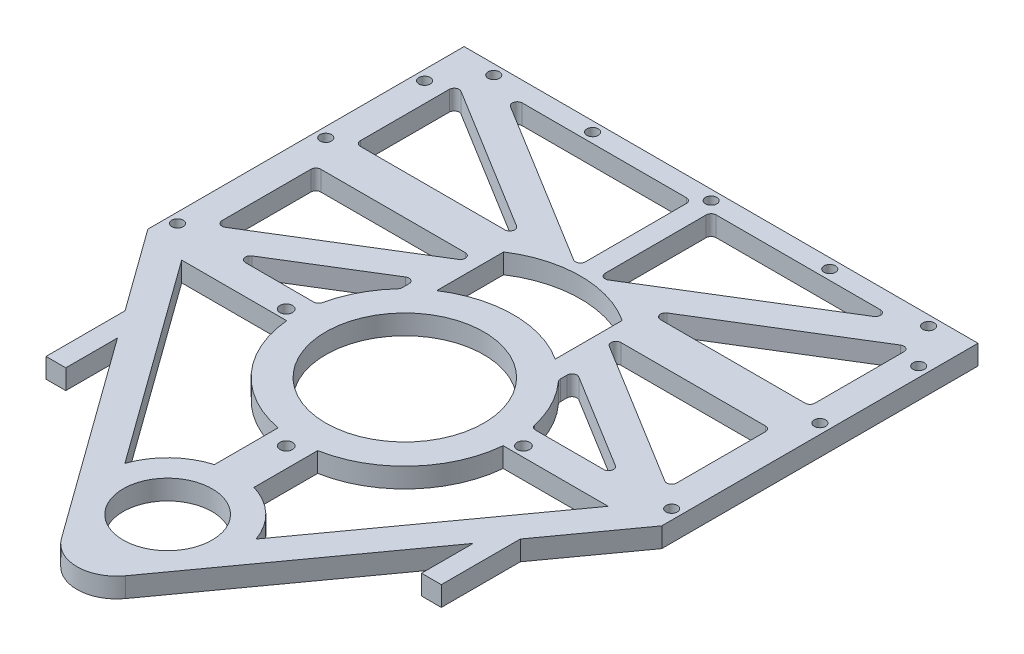
from build123d import *

# Parameters (mm, degrees)
BOSS_EXTRUDE1_DEPTH        = 6.35
BOSS_EXTRUDE2_DEPTH        = 6.35
CUT_EXTRUDE2_REACH         = 178.705
SKETCH3_R                  = 25.4
SKETCH3_R_2                = 14.2875
F_6_CLEARANCE_HOLE1_D      = 3.6576
TAP_DRILL_FOR_10_32_TAP1_D = 4.0386


with BuildPart() as part:
    # Sketch1 → Boss-Extrude1 (new body)
    with BuildSketch(Plane(origin=(0, 0, 0), x_dir=(1, 0, 0), z_dir=(0, 1, 0))):
        with BuildLine():
            Line((-82.55, -50.8), (-10.295626201, -150.844517568))
            ThreePointArc((-10.295626201, -150.844517568), (0, -156.108787534), (10.295626201, -150.844517568))
            Line((10.295626201, -150.844517568), (82.55, -50.8))
            Line((82.55, -50.8), (82.55, 50.8))
            Line((82.55, 50.8), (-82.55, 50.8))
            Line((-82.55, 50.8), (-82.55, -50.8))
        make_face()
    extrude(amount=BOSS_EXTRUDE1_DEPTH)

    # Sketch4 → Boss-Extrude2 (add)
    with BuildSketch(Plane(origin=(0, 6.35, 0), x_dir=(1, 0, 0), z_dir=(0, 1, 0))):
        Polygon((-63.5, -77.176923077), (-63.5, -102.576923077), (-57.15, -102.576923077), (-57.15, -85.969230769), align=None)
        Polygon((57.15, -102.576923077), (63.5, -102.576923077), (63.5, -77.176923077), (57.15, -85.969230769), align=None)
    extrude(amount=-BOSS_EXTRUDE2_DEPTH)

    # Sketch3 → Cut-Extrude2 (cut, up to next)
    with BuildSketch(Plane(origin=(0, 6.35, 0), x_dir=(1, 0, 0), z_dir=(0, 1, 0)), mode=Mode.PRIVATE) as cut_extrude2_sk1:
        with Locations(Location((0, -50.8, 0), (0, 0, 270))):
            Circle(SKETCH3_R)
    cut_extrude2_tool1 = extrude(cut_extrude2_sk1.sketch, amount=-CUT_EXTRUDE2_REACH, mode=Mode.PRIVATE) & part.part
    # Sketch3 → Cut-Extrude2 (cut, up to next)
    with BuildSketch(Plane(origin=(0, 6.35, 0), x_dir=(1, 0, 0), z_dir=(0, 1, 0)), mode=Mode.PRIVATE) as cut_extrude2_sk2:
        with Locations(Location((0, -127, 0), (0, 0, 270))):
            Circle(SKETCH3_R_2)
    cut_extrude2_tool2 = extrude(cut_extrude2_sk2.sketch, amount=-CUT_EXTRUDE2_REACH, mode=Mode.PRIVATE) & part.part
    # Sketch3 → Cut-Extrude2 (cut, up to next)
    with BuildSketch(Plane(origin=(0, 6.35, 0), x_dir=(1, 0, 0), z_dir=(0, 1, 0)), mode=Mode.PRIVATE) as cut_extrude2_sk3:
        with BuildLine():
            Line((-58.367499255, 41.510492422), (-5.594504663, 9.034803443))
            ThreePointArc((-5.594504663, 9.034803443), (-3.988113518, 9.000996521), (-3.175, 10.386811021))
            Line((-3.175, 10.386811021), (-3.175, 42.8625))
            ThreePointArc((-3.175, 42.8625), (-3.639967985, 43.985032015), (-4.7625, 44.45))
            Line((-4.7625, 44.45), (-57.535494592, 44.45))
            ThreePointArc((-57.535494592, 44.45), (-59.062987354, 43.294844897), (-58.367499255, 41.510492422))
        make_face()
    cut_extrude2_tool3 = extrude(cut_extrude2_sk3.sketch, amount=-CUT_EXTRUDE2_REACH, mode=Mode.PRIVATE) & part.part
    # Sketch3 → Cut-Extrude2 (cut, up to next)
    with BuildSketch(Plane(origin=(0, 6.35, 0), x_dir=(1, 0, 0), z_dir=(0, 1, 0)), mode=Mode.PRIVATE) as cut_extrude2_sk4:
        with BuildLine():
            Line((-73.025, 36.505496672), (-73.025, 7.9375))
            ThreePointArc((-73.025, 7.9375), (-72.560032015, 6.814967985), (-71.4375, 6.35))
            Line((-71.4375, 6.35), (-25.014505408, 6.35))
            ThreePointArc((-25.014505408, 6.35), (-23.487012646, 7.505155103), (-24.182500745, 9.289507578))
            Line((-24.182500745, 9.289507578), (-70.605495337, 37.857504249))
            ThreePointArc((-70.605495337, 37.857504249), (-72.211886482, 37.891311171), (-73.025, 36.505496672))
        make_face()
    cut_extrude2_tool4 = extrude(cut_extrude2_sk4.sketch, amount=-CUT_EXTRUDE2_REACH, mode=Mode.PRIVATE) & part.part
    # Sketch3 → Cut-Extrude2 (cut, up to next)
    with BuildSketch(Plane(origin=(0, 6.35, 0), x_dir=(1, 0, 0), z_dir=(0, 1, 0)), mode=Mode.PRIVATE) as cut_extrude2_sk5:
        with BuildLine():
            Line((4.7625, 44.45), (57.535494592, 44.45))
            ThreePointArc((57.535494592, 44.45), (59.062987354, 43.294844897), (58.367499255, 41.510492422))
            Line((58.367499255, 41.510492422), (5.594504663, 9.034803443))
            ThreePointArc((5.594504663, 9.034803443), (3.988113518, 9.000996521), (3.175, 10.386811021))
            Line((3.175, 10.386811021), (3.175, 42.8625))
            ThreePointArc((3.175, 42.8625), (3.639967985, 43.985032015), (4.7625, 44.45))
        make_face()
    cut_extrude2_tool5 = extrude(cut_extrude2_sk5.sketch, amount=-CUT_EXTRUDE2_REACH, mode=Mode.PRIVATE) & part.part
    # Sketch3 → Cut-Extrude2 (cut, up to next)
    with BuildSketch(Plane(origin=(0, 6.35, 0), x_dir=(1, 0, 0), z_dir=(0, 1, 0)), mode=Mode.PRIVATE) as cut_extrude2_sk6:
        with BuildLine():
            Line((24.182500745, 9.289507578), (70.605495337, 37.857504249))
            ThreePointArc((70.605495337, 37.857504249), (72.211886482, 37.891311171), (73.025, 36.505496672))
            Line((73.025, 36.505496672), (73.025, 7.9375))
            ThreePointArc((73.025, 7.9375), (72.560032015, 6.814967985), (71.4375, 6.35))
            Line((71.4375, 6.35), (25.014505408, 6.35))
            ThreePointArc((25.014505408, 6.35), (23.487012646, 7.505155103), (24.182500745, 9.289507578))
        make_face()
    cut_extrude2_tool6 = extrude(cut_extrude2_sk6.sketch, amount=-CUT_EXTRUDE2_REACH, mode=Mode.PRIVATE) & part.part
    # Sketch3 → Cut-Extrude2 (cut, up to next)
    with BuildSketch(Plane(origin=(0, 6.35, 0), x_dir=(1, 0, 0), z_dir=(0, 1, 0)), mode=Mode.PRIVATE) as cut_extrude2_sk7:
        with BuildLine():
            Line((73.025, -36.505496672), (73.025, -7.9375))
            ThreePointArc((73.025, -7.9375), (72.560032015, -6.814967985), (71.4375, -6.35))
            Line((71.4375, -6.35), (25.014505408, -6.35))
            ThreePointArc((25.014505408, -6.35), (23.487012646, -7.505155103), (24.182500745, -9.289507578))
            Line((24.182500745, -9.289507578), (70.605495337, -37.857504249))
            ThreePointArc((70.605495337, -37.857504249), (72.211886482, -37.891311171), (73.025, -36.505496672))
        make_face()
    cut_extrude2_tool7 = extrude(cut_extrude2_sk7.sketch, amount=-CUT_EXTRUDE2_REACH, mode=Mode.PRIVATE) & part.part
    # Sketch3 → Cut-Extrude2 (cut, up to next)
    with BuildSketch(Plane(origin=(0, 6.35, 0), x_dir=(1, 0, 0), z_dir=(0, 1, 0)), mode=Mode.PRIVATE) as cut_extrude2_sk8:
        with BuildLine():
            Line((-24.182500745, -9.289507578), (-70.605495337, -37.857504249))
            ThreePointArc((-70.605495337, -37.857504249), (-72.211886482, -37.891311171), (-73.025, -36.505496672))
            Line((-73.025, -36.505496672), (-73.025, -7.9375))
            ThreePointArc((-73.025, -7.9375), (-72.560032015, -6.814967985), (-71.4375, -6.35))
            Line((-71.4375, -6.35), (-25.014505408, -6.35))
            ThreePointArc((-25.014505408, -6.35), (-23.487012646, -7.505155103), (-24.182500745, -9.289507578))
        make_face()
    cut_extrude2_tool8 = extrude(cut_extrude2_sk8.sketch, amount=-CUT_EXTRUDE2_REACH, mode=Mode.PRIVATE) & part.part
    # Sketch3 → Cut-Extrude2 (cut, up to next)
    with BuildSketch(Plane(origin=(0, 6.35, 0), x_dir=(1, 0, 0), z_dir=(0, 1, 0)), mode=Mode.PRIVATE) as cut_extrude2_sk9:
        with BuildLine():
            Line((-6.35, -85.142875899), (-6.35, -105.615701316))
            ThreePointArc((-6.35, -105.615701316), (-15.402705776, -110.864096399), (-21.066111407, -119.663128703))
            Line((-21.066111407, -119.663128703), (-68.507537692, -53.975))
            Line((-68.507537692, -53.975), (-34.780382402, -53.975))
            ThreePointArc((-34.780382402, -53.975), (-25.802833394, -74.336554843), (-6.35, -85.142875899))
        make_face()
    cut_extrude2_tool9 = extrude(cut_extrude2_sk9.sketch, amount=-CUT_EXTRUDE2_REACH, mode=Mode.PRIVATE) & part.part
    # Sketch3 → Cut-Extrude2 (cut, up to next)
    with BuildSketch(Plane(origin=(0, 6.35, 0), x_dir=(1, 0, 0), z_dir=(0, 1, 0)), mode=Mode.PRIVATE) as cut_extrude2_sk10:
        with BuildLine():
            Line((6.35, -85.142875899), (6.35, -105.615701316))
            ThreePointArc((6.35, -105.615701316), (15.402705776, -110.864096399), (21.066111407, -119.663128703))
            Line((21.066111407, -119.663128703), (68.507537692, -53.975))
            Line((68.507537692, -53.975), (34.780382402, -53.975))
            ThreePointArc((34.780382402, -53.975), (25.802833394, -74.336554843), (6.35, -85.142875899))
        make_face()
    cut_extrude2_tool10 = extrude(cut_extrude2_sk10.sketch, amount=-CUT_EXTRUDE2_REACH, mode=Mode.PRIVATE) & part.part
    # Sketch3 → Cut-Extrude2 (cut, up to next)
    with BuildSketch(Plane(origin=(0, 6.35, 0), x_dir=(1, 0, 0), z_dir=(0, 1, 0)), mode=Mode.PRIVATE) as cut_extrude2_sk11:
        with BuildLine():
            Line((-19.05, -21.527946348), (-19.05, 0))
            ThreePointArc((-19.05, 0), (0, 5.652946348), (19.05, 0))
            Line((19.05, 0), (19.05, -21.527946348))
            ThreePointArc((19.05, -21.527946348), (0, -15.875), (-19.05, -21.527946348))
        make_face()
    cut_extrude2_tool11 = extrude(cut_extrude2_sk11.sketch, amount=-CUT_EXTRUDE2_REACH, mode=Mode.PRIVATE) & part.part
    # Sketch3 → Cut-Extrude2 (cut, up to next)
    with BuildSketch(Plane(origin=(0, 6.35, 0), x_dir=(1, 0, 0), z_dir=(0, 1, 0)), mode=Mode.PRIVATE) as cut_extrude2_sk12:
        with BuildLine():
            Line((-57.535494592, -44.45), (-35.639286609, -44.45))
            ThreePointArc((-35.639286609, -44.45), (-34.646236712, -44.101050827), (-34.089752409, -43.207608696))
            ThreePointArc((-34.089752409, -43.207608696), (-30.993130541, -34.700885606), (-25.814130435, -27.275835936))
            ThreePointArc((-25.814130435, -27.275835936), (-25.507148617, -26.779893377), (-25.4, -26.206555752))
            Line((-25.4, -26.206555752), (-25.4, -24.063734098))
            ThreePointArc((-25.4, -24.063734098), (-26.213113518, -22.677919598), (-27.819504663, -22.71172652))
            Line((-27.819504663, -22.71172652), (-58.367499255, -41.510492422))
            ThreePointArc((-58.367499255, -41.510492422), (-59.062987354, -43.294844897), (-57.535494592, -44.45))
        make_face()
    cut_extrude2_tool12 = extrude(cut_extrude2_sk12.sketch, amount=-CUT_EXTRUDE2_REACH, mode=Mode.PRIVATE) & part.part
    # Sketch3 → Cut-Extrude2 (cut, up to next)
    with BuildSketch(Plane(origin=(0, 6.35, 0), x_dir=(1, 0, 0), z_dir=(0, 1, 0)), mode=Mode.PRIVATE) as cut_extrude2_sk13:
        with BuildLine():
            Line((25.4, -24.063734098), (25.4, -26.206555752))
            ThreePointArc((25.4, -26.206555752), (25.507148617, -26.779893377), (25.814130435, -27.275835936))
            ThreePointArc((25.814130435, -27.275835936), (30.993130541, -34.700885606), (34.089752409, -43.207608696))
            ThreePointArc((34.089752409, -43.207608696), (34.646236712, -44.101050827), (35.639286609, -44.45))
            Line((35.639286609, -44.45), (57.535494592, -44.45))
            ThreePointArc((57.535494592, -44.45), (59.062987354, -43.294844897), (58.367499255, -41.510492422))
            Line((58.367499255, -41.510492422), (27.819504663, -22.71172652))
            ThreePointArc((27.819504663, -22.71172652), (26.213113518, -22.677919598), (25.4, -24.063734098))
        make_face()
    cut_extrude2_tool13 = extrude(cut_extrude2_sk13.sketch, amount=-CUT_EXTRUDE2_REACH, mode=Mode.PRIVATE) & part.part
    add(cut_extrude2_tool1.solids().sort_by_distance((0, 6.35, 50.8))[0], mode=Mode.SUBTRACT)
    add(cut_extrude2_tool2.solids().sort_by_distance((0, 6.35, 127))[0], mode=Mode.SUBTRACT)
    add(cut_extrude2_tool3.solids().sort_by_distance((-23.016302, 6.35, -32.123089))[0], mode=Mode.SUBTRACT)
    add(cut_extrude2_tool4.solids().sort_by_distance((-55.316443, 6.35, -17.377083))[0], mode=Mode.SUBTRACT)
    add(cut_extrude2_tool5.solids().sort_by_distance((23.016302, 6.35, -32.123089))[0], mode=Mode.SUBTRACT)
    add(cut_extrude2_tool6.solids().sort_by_distance((55.316443, 6.35, -17.377083))[0], mode=Mode.SUBTRACT)
    add(cut_extrude2_tool7.solids().sort_by_distance((55.316443, 6.35, 17.377083))[0], mode=Mode.SUBTRACT)
    add(cut_extrude2_tool8.solids().sort_by_distance((-55.316443, 6.35, 17.377083))[0], mode=Mode.SUBTRACT)
    add(cut_extrude2_tool9.solids().sort_by_distance((-32.99022, 6.35, 82.3723))[0], mode=Mode.SUBTRACT)
    add(cut_extrude2_tool10.solids().sort_by_distance((32.99022, 6.35, 82.3723))[0], mode=Mode.SUBTRACT)
    add(cut_extrude2_tool11.solids().sort_by_distance((0, 6.35, 6.929783))[0], mode=Mode.SUBTRACT)
    add(cut_extrude2_tool12.solids().sort_by_distance((-40.378487, 6.35, 36.296551))[0], mode=Mode.SUBTRACT)
    add(cut_extrude2_tool13.solids().sort_by_distance((40.378487, 6.35, 36.296551))[0], mode=Mode.SUBTRACT)

    # #6 Clearance Hole1 (through all)
    with Locations(Plane(origin=(0, 6.35, 0), x_dir=(1, 0, 0), z_dir=(0, 1, 0))):
        with Locations((-79.375, -44.45), (-79.375, 3.175), (-69.85, 47.625), (-79.375, 34.925), (-38.1, 47.625), (0, 47.625), (38.1, 47.625), (69.85, 47.625), (79.375, 34.925), (79.375, 3.175), (79.375, -44.45)):
            Hole(F_6_CLEARANCE_HOLE1_D / 2)

    # Tap Drill for #10-32 Tap1 (through all)
    with Locations(Plane(origin=(0, 6.35, 0), x_dir=(1, 0, 0), z_dir=(0, 1, 0))):
        with Locations((-38.1, -50.8), (0, -88.9), (38.1, -50.8)):
            Hole(TAP_DRILL_FOR_10_32_TAP1_D / 2)


solid = part.part
